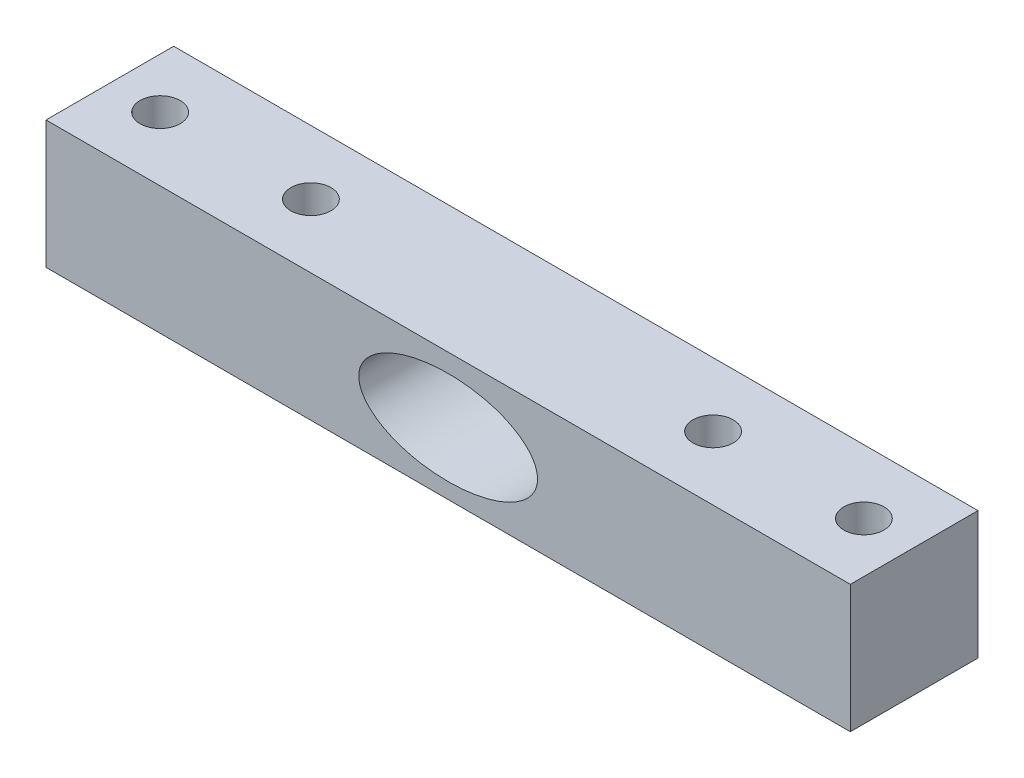
from build123d import *

# Parameters (mm, degrees)
SKETCH2_W           = 80
SKETCH2_H           = 12.7
BOSS_EXTRUDE1_DEPTH = 12.7
SKETCH3_R           = 2
CUT_EXTRUDE1_DEPTH  = 43.445406112
SKETCH4_RX          = 8.89
SKETCH4_RY          = 4.6609
CUT_EXTRUDE3_DEPTH  = 44.847234804


with BuildPart() as part:
    # Sketch2 → Boss-Extrude1 (new body)
    with BuildSketch(Plane(origin=(0, 0, 0), x_dir=(1, 0, 0), z_dir=(0, 1, 0))):
        Rectangle(SKETCH2_W, SKETCH2_H)
    extrude(amount=BOSS_EXTRUDE1_DEPTH)

    # Sketch3 → Cut-Extrude1 (cut, through all)
    with BuildSketch(Plane(origin=(0, 12.7, 0), x_dir=(1, 0, 0), z_dir=(0, 1, 0))):
        with Locations(Location((-35, 0, 0), (0, 0, 270))):
            Circle(SKETCH3_R)
        with Locations(Location((-20, 0, 0), (0, 0, 270))):
            Circle(SKETCH3_R)
        with Locations(Location((35, 0, 0), (0, 0, 270))):
            Circle(SKETCH3_R)
        with Locations(Location((20, 0, 0), (0, 0, 270))):
            Circle(SKETCH3_R)
    extrude(amount=-CUT_EXTRUDE1_DEPTH, mode=Mode.SUBTRACT)

    # Sketch4 → Cut-Extrude3 (cut, through all)
    with BuildSketch(Plane.XY.offset(6.35)):
        with Locations((0, 6.20775407)):
            Ellipse(SKETCH4_RX, SKETCH4_RY)
    extrude(amount=-CUT_EXTRUDE3_DEPTH, mode=Mode.SUBTRACT)


solid = part.part
